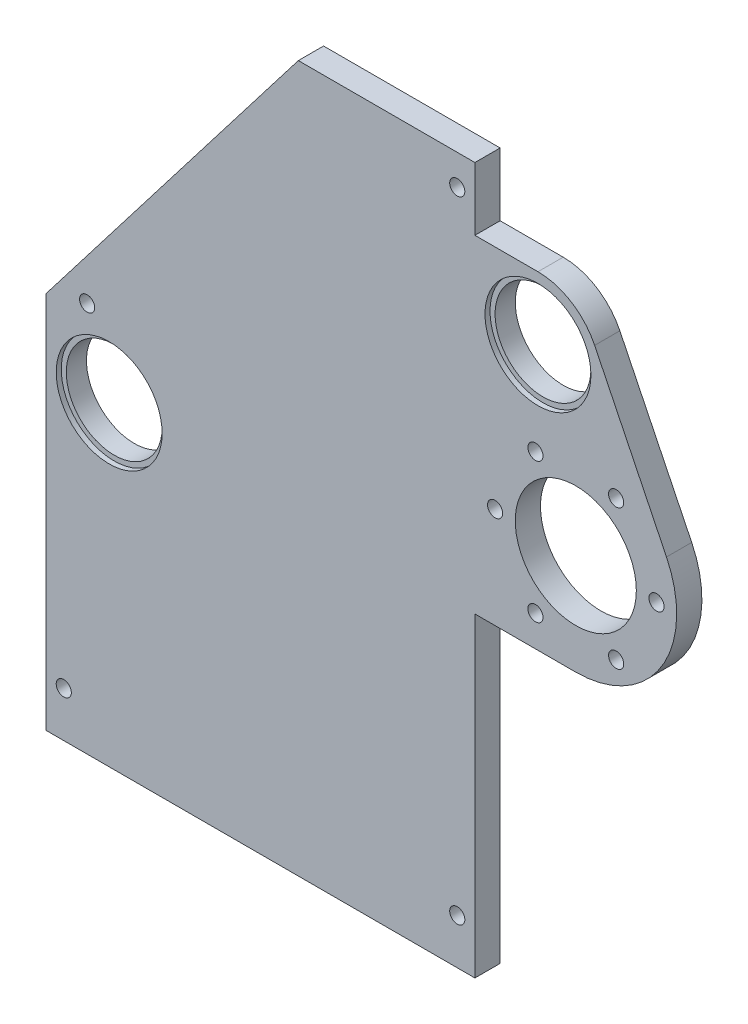
from build123d import *

# Parameters (mm, degrees)
SKETCH1_R           = 1.5
SKETCH1_R_2         = 10.5
SKETCH1_R_3         = 12
BOSS_EXTRUDE1_DEPTH = 5
SKETCH1_3_R         = 10.5
SKETCH1_3_R_2       = 9.5
BOSS_EXTRUDE2_DEPTH = 4


with BuildPart() as part:
    # Sketch1 → Boss-Extrude1 (new body)
    with BuildSketch(Plane.XY):
        with BuildLine():
            Line((-25, 0), (60, 0))
            Line((60, 0), (60, 62.5))
            Line((60, 62.5), (80, 62.5))
            ThreePointArc((80, 62.5), (96.95996608, 71.9000212), (97.97752809, 91.264044944))
            Line((97.97752809, 91.264044944), (83.735955056, 120.47752809))
            ThreePointArc((83.735955056, 120.47752809), (79.12498675, 125.5999788), (72.5, 127.5))
            Line((72.5, 127.5), (60, 127.5))
            Line((60, 127.5), (60, 140))
            Line((60, 140), (25, 140))
            Line((25, 140), (-25, 75))
            Line((-25, 75), (-25, 0))
        make_face()
        with Locations((-21.5, 9)):
            Circle(SKETCH1_R, mode=Mode.SUBTRACT)
        with Locations((-12.5, 62.5)):
            Circle(SKETCH1_R_2, mode=Mode.SUBTRACT)
        with Locations((56.5, 9)):
            Circle(SKETCH1_R, mode=Mode.SUBTRACT)
        with Locations((56.5, 134)):
            Circle(SKETCH1_R, mode=Mode.SUBTRACT)
        with Locations((-16.867190649, 77.372042423)):
            Circle(SKETCH1_R, mode=Mode.SUBTRACT)
        with Locations((72.5, 115)):
            Circle(SKETCH1_R_2, mode=Mode.SUBTRACT)
        with Locations((88, 96.356406461)):
            Circle(SKETCH1_R, mode=Mode.SUBTRACT)
        with Locations((72, 96.356406461)):
            Circle(SKETCH1_R, mode=Mode.SUBTRACT)
        with Locations((72, 68.643593539)):
            Circle(SKETCH1_R, mode=Mode.SUBTRACT)
        with Locations((88, 68.643593539)):
            Circle(SKETCH1_R, mode=Mode.SUBTRACT)
        with Locations((64, 82.5)):
            Circle(SKETCH1_R, mode=Mode.SUBTRACT)
        with Locations((80, 82.5)):
            Circle(SKETCH1_R_3, mode=Mode.SUBTRACT)
        with Locations((96, 82.5)):
            Circle(SKETCH1_R, mode=Mode.SUBTRACT)
    extrude(amount=BOSS_EXTRUDE1_DEPTH)

    # Sketch1<3> → Boss-Extrude2 (add)
    # profile 1 of 2: a face of its own
    with BuildSketch(Plane.XY):
        with Locations((-12.5, 62.5)):
            Circle(SKETCH1_3_R)
        with Locations((-12.5, 62.5)):
            Circle(SKETCH1_3_R_2, mode=Mode.SUBTRACT)
    # profile 2 of 2: a face of its own
    with BuildSketch(Plane.XY):
        with Locations((72.5, 115)):
            Circle(SKETCH1_3_R)
        with Locations((72.5, 115)):
            Circle(SKETCH1_3_R_2, mode=Mode.SUBTRACT)
    extrude(amount=BOSS_EXTRUDE2_DEPTH)


solid = part.part
